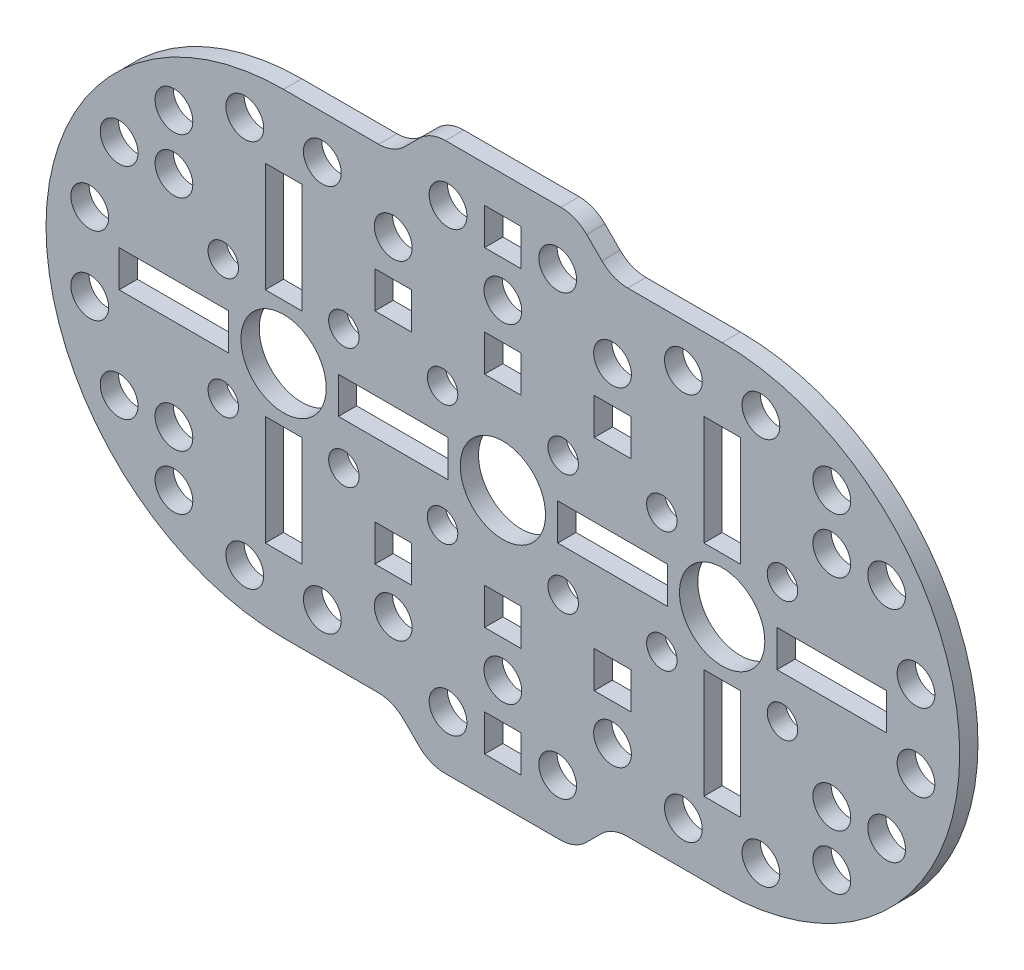
from build123d import *

# Parameters (mm, degrees)
MODEL_R                 = 1.25
MODEL_R_2               = 3.5
MODEL_R_3               = 1.55
MODEL_W                 = 9
MODEL_H                 = 3
MODEL_W_2               = 3
MODEL_H_2               = 9
SALIENTE_EXTRUIR1_DEPTH = 1.5


with BuildPart() as part:
    # Model → Saliente-Extruir1 (new body)
    with BuildSketch(Plane.XY):
        with BuildLine():
            Line((63.795544402, 295.852296768), (56.038185089, 295.852296768))
            ThreePointArc((56.038185089, 295.852296768), (54.890134792, 296.080658171), (53.916864745, 296.730976425))
            Line((53.916864745, 296.730976425), (52.674224058, 297.973617112))
            ThreePointArc((52.674224058, 297.973617112), (51.700954012, 298.623935366), (50.552903715, 298.852296768))
            Line((50.552903715, 298.852296768), (41.085229894, 298.852296768))
            ThreePointArc((41.085229894, 298.852296768), (39.937179597, 298.623935366), (38.96390955, 297.973617112))
            Line((38.96390955, 297.973617112), (37.721268863, 296.730976425))
            ThreePointArc((37.721268863, 296.730976425), (36.747998817, 296.080658171), (35.59994852, 295.852296768))
            Line((35.59994852, 295.852296768), (27.795544402, 295.852296768))
            ThreePointArc((27.795544402, 295.852296768), (8.295544402, 276.352296768), (27.795544402, 256.852296768))
            Line((27.795544402, 256.852296768), (35.552903715, 256.852296768))
            ThreePointArc((35.552903715, 256.852296768), (36.700954012, 256.623935366), (37.674224058, 255.973617112))
            Line((37.674224058, 255.973617112), (38.916864745, 254.730976425))
            ThreePointArc((38.916864745, 254.730976425), (39.890134792, 254.080658171), (41.038185089, 253.852296768))
            Line((41.038185089, 253.852296768), (50.50585891, 253.852296768))
            ThreePointArc((50.50585891, 253.852296768), (51.653909207, 254.080658171), (52.627179253, 254.730976425))
            Line((52.627179253, 254.730976425), (53.86981994, 255.973617112))
            ThreePointArc((53.86981994, 255.973617112), (54.843089987, 256.623935366), (55.991140284, 256.852296768))
            Line((55.991140284, 256.852296768), (63.795544402, 256.852296768))
            ThreePointArc((63.795544402, 256.852296768), (83.295544402, 276.352296768), (63.795544402, 295.852296768))
        make_face()
        with Locations((22.845796934, 281.302044237)):
            Circle(MODEL_R, mode=Mode.SUBTRACT)
        with Locations((22.845796934, 271.4025493)):
            Circle(MODEL_R, mode=Mode.SUBTRACT)
        with Locations((32.74529187, 271.4025493)):
            Circle(MODEL_R, mode=Mode.SUBTRACT)
        with Locations((32.74529187, 281.302044237)):
            Circle(MODEL_R, mode=Mode.SUBTRACT)
        with Locations((27.795544402, 276.352296768)):
            Circle(MODEL_R_2, mode=Mode.SUBTRACT)
        with Locations((18.795544402, 289.852296768)):
            Circle(MODEL_R_3, mode=Mode.SUBTRACT)
        with Locations((18.795544402, 262.852296768)):
            Circle(MODEL_R_3, mode=Mode.SUBTRACT)
        with Locations((36.795544402, 289.852296768)):
            Circle(MODEL_R_3, mode=Mode.SUBTRACT)
        with Locations((36.795544402, 262.852296768)):
            Circle(MODEL_R_3, mode=Mode.SUBTRACT)
        with Locations((14.295544402, 267.352296768)):
            Circle(MODEL_R_3, mode=Mode.SUBTRACT)
        with Locations((14.295544402, 285.352296768)):
            Circle(MODEL_R_3, mode=Mode.SUBTRACT)
        with Locations((30.977524917, 292.262199345)):
            Circle(MODEL_R_3, mode=Mode.SUBTRACT)
        with Locations((24.613563886, 260.442394192)):
            Circle(MODEL_R_3, mode=Mode.SUBTRACT)
        with Locations((30.977524917, 260.442394192)):
            Circle(MODEL_R_3, mode=Mode.SUBTRACT)
        with Locations((24.613563886, 292.262199345)):
            Circle(MODEL_R_3, mode=Mode.SUBTRACT)
        with Locations((11.885641825, 279.534277284)):
            Circle(MODEL_R_3, mode=Mode.SUBTRACT)
        with Locations((11.885641825, 273.170316253)):
            Circle(MODEL_R_3, mode=Mode.SUBTRACT)
        with Locations((58.845796933, 281.302044237)):
            Circle(MODEL_R, mode=Mode.SUBTRACT)
        with Locations((58.845796933, 271.4025493)):
            Circle(MODEL_R, mode=Mode.SUBTRACT)
        with Locations((68.74529187, 271.4025493)):
            Circle(MODEL_R, mode=Mode.SUBTRACT)
        with Locations((68.74529187, 281.302044237)):
            Circle(MODEL_R, mode=Mode.SUBTRACT)
        with Locations((54.795544402, 289.852296768)):
            Circle(MODEL_R_3, mode=Mode.SUBTRACT)
        with Locations((54.795544402, 262.852296768)):
            Circle(MODEL_R_3, mode=Mode.SUBTRACT)
        with Locations((72.795544402, 289.852296768)):
            Circle(MODEL_R_3, mode=Mode.SUBTRACT)
        with Locations((72.795544402, 262.852296768)):
            Circle(MODEL_R_3, mode=Mode.SUBTRACT)
        with Locations((77.295544402, 267.352296768)):
            Circle(MODEL_R_3, mode=Mode.SUBTRACT)
        with Locations((77.295544402, 285.352296768)):
            Circle(MODEL_R_3, mode=Mode.SUBTRACT)
        with Locations((66.977524917, 292.262199345)):
            Circle(MODEL_R_3, mode=Mode.SUBTRACT)
        with Locations((60.613563886, 260.442394192)):
            Circle(MODEL_R_3, mode=Mode.SUBTRACT)
        with Locations((66.977524917, 260.442394192)):
            Circle(MODEL_R_3, mode=Mode.SUBTRACT)
        with Locations((60.613563886, 292.262199345)):
            Circle(MODEL_R_3, mode=Mode.SUBTRACT)
        with Locations((79.705446979, 273.170316253)):
            Circle(MODEL_R_3, mode=Mode.SUBTRACT)
        with Locations((79.705446979, 279.534277284)):
            Circle(MODEL_R_3, mode=Mode.SUBTRACT)
        with Locations((63.795544402, 276.352296768)):
            Circle(MODEL_R_2, mode=Mode.SUBTRACT)
        with Locations((18.795544402, 285.352296768)):
            Circle(MODEL_R_3, mode=Mode.SUBTRACT)
        with Locations((18.795544402, 267.352296768)):
            Circle(MODEL_R_3, mode=Mode.SUBTRACT)
        with Locations((72.795544402, 285.352296768)):
            Circle(MODEL_R_3, mode=Mode.SUBTRACT)
        with Locations((72.795544402, 267.352296768)):
            Circle(MODEL_R_3, mode=Mode.SUBTRACT)
        with Locations((40.845796933, 281.302044237)):
            Circle(MODEL_R, mode=Mode.SUBTRACT)
        with Locations((40.845796933, 271.4025493)):
            Circle(MODEL_R, mode=Mode.SUBTRACT)
        with Locations((50.74529187, 271.4025493)):
            Circle(MODEL_R, mode=Mode.SUBTRACT)
        with Locations((50.74529187, 281.302044237)):
            Circle(MODEL_R, mode=Mode.SUBTRACT)
        with Locations((45.795544402, 276.352296768)):
            Circle(MODEL_R_2, mode=Mode.SUBTRACT)
        with Locations((41.295544402, 294.352296768)):
            Circle(MODEL_R_3, mode=Mode.SUBTRACT)
        with Locations((50.295544402, 294.352296768)):
            Circle(MODEL_R_3, mode=Mode.SUBTRACT)
        with Locations((45.795544402, 289.852296768)):
            Circle(MODEL_R_3, mode=Mode.SUBTRACT)
        with Locations((41.295544402, 258.352296768)):
            Circle(MODEL_R_3, mode=Mode.SUBTRACT)
        with Locations((50.295544402, 258.352296768)):
            Circle(MODEL_R_3, mode=Mode.SUBTRACT)
        with Locations((45.795544402, 262.852296768)):
            Circle(MODEL_R_3, mode=Mode.SUBTRACT)
        with Locations((36.795544402, 276.352296768)):
            Rectangle(MODEL_W, MODEL_H, mode=Mode.SUBTRACT)
        with Locations((27.795544402, 285.352296768)):
            Rectangle(MODEL_W_2, MODEL_H_2, mode=Mode.SUBTRACT)
        with Locations((18.795544402, 276.352296768)):
            Rectangle(MODEL_W, MODEL_H, mode=Mode.SUBTRACT)
        with Locations((27.795544402, 267.352296768)):
            Rectangle(MODEL_W_2, MODEL_H_2, mode=Mode.SUBTRACT)
        with Locations((72.795544402, 276.352296768)):
            Rectangle(MODEL_W, MODEL_H, mode=Mode.SUBTRACT)
        with Locations((63.795544402, 285.352296768)):
            Rectangle(MODEL_W_2, MODEL_H_2, mode=Mode.SUBTRACT)
        with Locations((54.795544402, 276.352296768)):
            Rectangle(MODEL_W, MODEL_H, mode=Mode.SUBTRACT)
        with Locations((63.795544402, 267.352296768)):
            Rectangle(MODEL_W_2, MODEL_H_2, mode=Mode.SUBTRACT)
        with Locations((36.795544402, 285.352296768)):
            Rectangle(MODEL_W_2, MODEL_H, mode=Mode.SUBTRACT)
        with Locations((45.795544402, 285.352296768)):
            Rectangle(MODEL_W_2, MODEL_H, mode=Mode.SUBTRACT)
        with Locations((54.795544402, 285.352296768)):
            Rectangle(MODEL_W_2, MODEL_H, mode=Mode.SUBTRACT)
        with Locations((36.795544402, 267.352296768)):
            Rectangle(MODEL_W_2, MODEL_H, mode=Mode.SUBTRACT)
        with Locations((45.795544402, 267.352296768)):
            Rectangle(MODEL_W_2, MODEL_H, mode=Mode.SUBTRACT)
        with Locations((54.795544402, 267.352296768)):
            Rectangle(MODEL_W_2, MODEL_H, mode=Mode.SUBTRACT)
        with Locations((45.795544402, 294.352296768)):
            Rectangle(MODEL_W_2, MODEL_H, mode=Mode.SUBTRACT)
        with Locations((45.795544402, 258.352296768)):
            Rectangle(MODEL_W_2, MODEL_H, mode=Mode.SUBTRACT)
    extrude(amount=SALIENTE_EXTRUIR1_DEPTH)


solid = part.part
